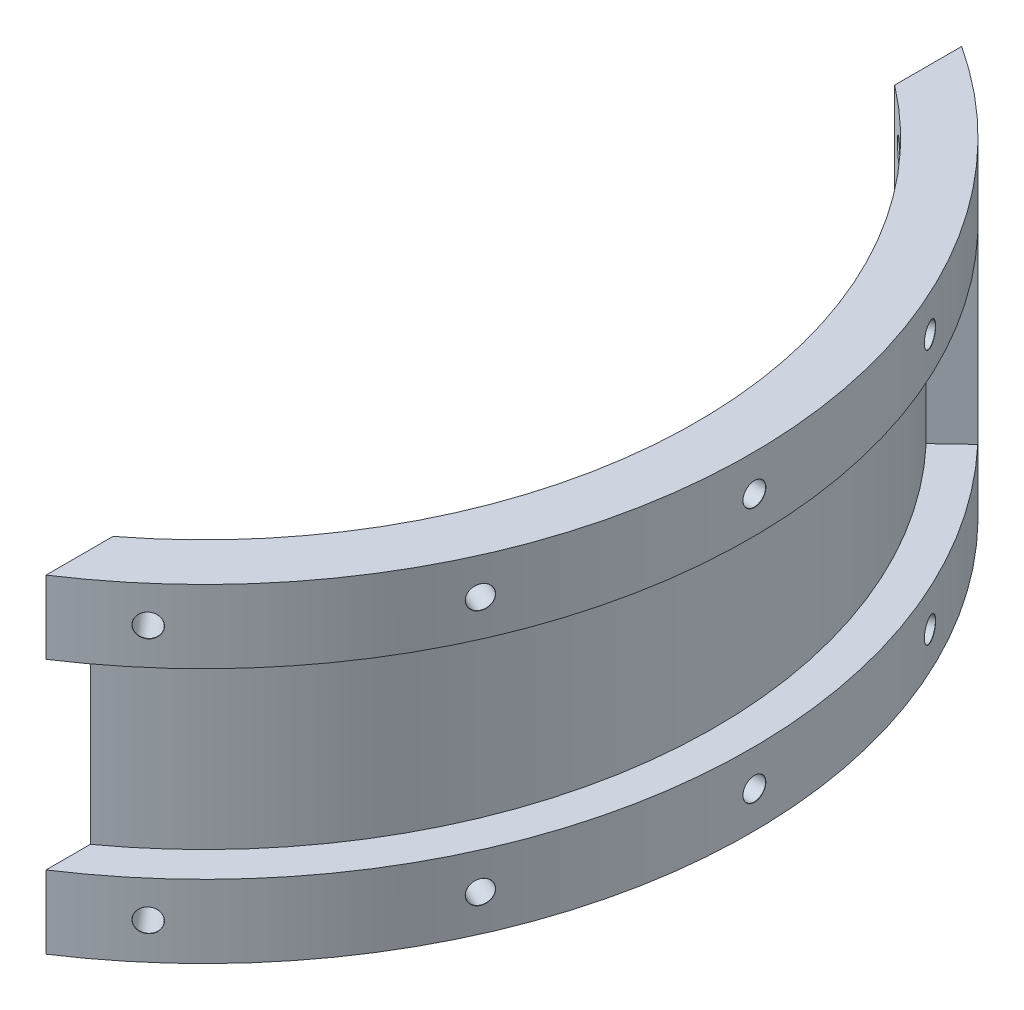
from build123d import *

# Parameters (mm, degrees)
BOSS_EXTRUDE1_DEPTH                             = 36
CUT_EXTRUDE1_DEPTH                              = 10
CUT_EXTRUDE1_DEPTH_BACK                         = 10
CUT_EXTRUDE1_START                              = -18
TAP_DRILL_FOR_M3X0_5_TAP3_D                     = 2.5
TAP_DRILL_FOR_M3X0_5_TAP3_DEPTH                 = 10
TAP_DRILL_FOR_M3X0_5_TAP3_CSINK_D               = 2.55
TAP_DRILL_FOR_M3X0_5_TAP3_CSINK_ANGLE           = 90
TAP_DRILL_FOR_M3X0_5_TAP3_TIP                   = 0.751075774
TAP_DRILL_FOR_M3X0_5_TAP3_ON_FACE_2_D           = 2.5
TAP_DRILL_FOR_M3X0_5_TAP3_ON_FACE_2_DEPTH       = 10
TAP_DRILL_FOR_M3X0_5_TAP3_ON_FACE_2_CSINK_D     = 2.55
TAP_DRILL_FOR_M3X0_5_TAP3_ON_FACE_2_CSINK_ANGLE = 90
TAP_DRILL_FOR_M3X0_5_TAP3_ON_FACE_2_TIP         = 0.751075774
TAP_DRILL_FOR_M3X0_5_TAP3_ON_FACE_3_D           = 2.5
TAP_DRILL_FOR_M3X0_5_TAP3_ON_FACE_3_DEPTH       = 10
TAP_DRILL_FOR_M3X0_5_TAP3_ON_FACE_3_CSINK_D     = 2.55
TAP_DRILL_FOR_M3X0_5_TAP3_ON_FACE_3_CSINK_ANGLE = 90
TAP_DRILL_FOR_M3X0_5_TAP3_ON_FACE_3_TIP         = 0.751075774
TAP_DRILL_FOR_M3X0_5_TAP3_ON_FACE_4_D           = 2.5
TAP_DRILL_FOR_M3X0_5_TAP3_ON_FACE_4_DEPTH       = 10
TAP_DRILL_FOR_M3X0_5_TAP3_ON_FACE_4_CSINK_D     = 2.55
TAP_DRILL_FOR_M3X0_5_TAP3_ON_FACE_4_CSINK_ANGLE = 90
TAP_DRILL_FOR_M3X0_5_TAP3_ON_FACE_4_TIP         = 0.751075774
TAP_DRILL_FOR_M3X0_5_TAP3_ON_FACE_5_D           = 2.5
TAP_DRILL_FOR_M3X0_5_TAP3_ON_FACE_5_DEPTH       = 10
TAP_DRILL_FOR_M3X0_5_TAP3_ON_FACE_5_CSINK_D     = 2.55
TAP_DRILL_FOR_M3X0_5_TAP3_ON_FACE_5_CSINK_ANGLE = 90
TAP_DRILL_FOR_M3X0_5_TAP3_ON_FACE_5_TIP         = 0.751075774
TAP_DRILL_FOR_M3X0_5_TAP3_ON_FACE_6_D           = 2.5
TAP_DRILL_FOR_M3X0_5_TAP3_ON_FACE_6_DEPTH       = 10
TAP_DRILL_FOR_M3X0_5_TAP3_ON_FACE_6_CSINK_D     = 2.55
TAP_DRILL_FOR_M3X0_5_TAP3_ON_FACE_6_CSINK_ANGLE = 90
TAP_DRILL_FOR_M3X0_5_TAP3_ON_FACE_6_TIP         = 0.751075774


with BuildPart() as part:
    # Sketch2 → Boss-Extrude1 (new body)
    with BuildSketch(Plane(origin=(0, 0, 0), x_dir=(1, 0, 0), z_dir=(0, 1, 0))):
        with BuildLine():
            Line((32.857314739, 42.853201375), (32.857314739, 50.203554338))
            ThreePointArc((32.857314739, 50.203554338), (60, 0), (32.857314739, -50.203554338))
            Line((32.857314739, -50.203554338), (32.857314739, -42.853201375))
            ThreePointArc((32.857314739, -42.853201375), (54, 0), (32.857314739, 42.853201375))
        make_face()
    extrude(amount=BOSS_EXTRUDE1_DEPTH)

    # Sketch4 → Cut-Extrude1 (cut, two sides: drawn at the far end of the back side and taken through both)
    with BuildSketch(Plane(origin=(0, 36, 0), x_dir=(1, 0, 0), z_dir=(0, 1, 0)).offset(CUT_EXTRUDE1_START - CUT_EXTRUDE1_DEPTH_BACK)):
        with BuildLine():
            Line((40.630746712, 38.53754561), (43.532942905, 41.290227439))
            ThreePointArc((43.532942905, 41.290227439), (55.124466648, -23.691626724), (0, -60))
            Line((0, -60), (0, -56))
            ThreePointArc((0, -56), (51.449502204, -22.112184942), (40.630746712, 38.53754561))
        make_face()
    extrude(amount=CUT_EXTRUDE1_DEPTH + CUT_EXTRUDE1_DEPTH_BACK, mode=Mode.SUBTRACT)

    # Tap Drill for M3x0.5 Tap3
    with Locations(Plane(origin=(39.244165272, 32, -45.386071565), x_dir=(-0.756434526077, 0, -0.654069421207), z_dir=(0.654069421207, 0, -0.756434526077))):
        with Locations((-1e-09, 0)):
            CounterSinkHole(TAP_DRILL_FOR_M3X0_5_TAP3_D / 2, TAP_DRILL_FOR_M3X0_5_TAP3_CSINK_D / 2, depth=TAP_DRILL_FOR_M3X0_5_TAP3_DEPTH, counter_sink_angle=TAP_DRILL_FOR_M3X0_5_TAP3_CSINK_ANGLE)
            with Locations((0, 0, -(TAP_DRILL_FOR_M3X0_5_TAP3_DEPTH + TAP_DRILL_FOR_M3X0_5_TAP3_TIP / 2))):  # 118° drill point
                Cone(0, TAP_DRILL_FOR_M3X0_5_TAP3_D / 2, TAP_DRILL_FOR_M3X0_5_TAP3_TIP, mode=Mode.SUBTRACT)

    # Tap Drill for M3x0.5 Tap3 on face 2
    with Locations(Plane(origin=(54.492928681, 32, -25.11017172), x_dir=(0.418503157518, 0, 0.908215341837), z_dir=(0.908215341837, 0, -0.418503157518))):
        with Locations((0, 0), (0, 28)):
            CounterSinkHole(TAP_DRILL_FOR_M3X0_5_TAP3_ON_FACE_2_D / 2, TAP_DRILL_FOR_M3X0_5_TAP3_ON_FACE_2_CSINK_D / 2, depth=TAP_DRILL_FOR_M3X0_5_TAP3_ON_FACE_2_DEPTH, counter_sink_angle=TAP_DRILL_FOR_M3X0_5_TAP3_ON_FACE_2_CSINK_ANGLE)
            with Locations((0, 0, -(TAP_DRILL_FOR_M3X0_5_TAP3_ON_FACE_2_DEPTH + TAP_DRILL_FOR_M3X0_5_TAP3_ON_FACE_2_TIP / 2))):  # 118° drill point
                Cone(0, TAP_DRILL_FOR_M3X0_5_TAP3_ON_FACE_2_D / 2, TAP_DRILL_FOR_M3X0_5_TAP3_ON_FACE_2_TIP, mode=Mode.SUBTRACT)

    # Tap Drill for M3x0.5 Tap3 on face 3
    with Locations(Plane(origin=(59.999008842, 32, -0.344873796), x_dir=(0.00574800276, 0, 0.999983480096), z_dir=(0.999983480096, 0, -0.00574800276))):
        with Locations((0, 0), (0, 28)):
            CounterSinkHole(TAP_DRILL_FOR_M3X0_5_TAP3_ON_FACE_3_D / 2, TAP_DRILL_FOR_M3X0_5_TAP3_ON_FACE_3_CSINK_D / 2, depth=TAP_DRILL_FOR_M3X0_5_TAP3_ON_FACE_3_DEPTH, counter_sink_angle=TAP_DRILL_FOR_M3X0_5_TAP3_ON_FACE_3_CSINK_ANGLE)
            with Locations((0, 0, -(TAP_DRILL_FOR_M3X0_5_TAP3_ON_FACE_3_DEPTH + TAP_DRILL_FOR_M3X0_5_TAP3_ON_FACE_3_TIP / 2))):  # 118° drill point
                Cone(0, TAP_DRILL_FOR_M3X0_5_TAP3_ON_FACE_3_D / 2, TAP_DRILL_FOR_M3X0_5_TAP3_ON_FACE_3_TIP, mode=Mode.SUBTRACT)

    # Tap Drill for M3x0.5 Tap3 on face 4
    with Locations(Plane(origin=(54.777984544, 32, 24.482083434), x_dir=(-0.408035106419, 0, 0.91296623811), z_dir=(0.91296623811, 0, 0.408035106419))):
        with Locations((-1e-09, 0), (-1e-09, 28)):
            CounterSinkHole(TAP_DRILL_FOR_M3X0_5_TAP3_ON_FACE_4_D / 2, TAP_DRILL_FOR_M3X0_5_TAP3_ON_FACE_4_CSINK_D / 2, depth=TAP_DRILL_FOR_M3X0_5_TAP3_ON_FACE_4_DEPTH, counter_sink_angle=TAP_DRILL_FOR_M3X0_5_TAP3_ON_FACE_4_CSINK_ANGLE)
            with Locations((0, 0, -(TAP_DRILL_FOR_M3X0_5_TAP3_ON_FACE_4_DEPTH + TAP_DRILL_FOR_M3X0_5_TAP3_ON_FACE_4_TIP / 2))):  # 118° drill point
                Cone(0, TAP_DRILL_FOR_M3X0_5_TAP3_ON_FACE_4_D / 2, TAP_DRILL_FOR_M3X0_5_TAP3_ON_FACE_4_TIP, mode=Mode.SUBTRACT)

    # Tap Drill for M3x0.5 Tap3 on face 5
    with Locations(Plane(origin=(39.244165272, 32, 45.386071565), x_dir=(0.756434937221, 0, -0.654068945717), z_dir=(0.654068945717, 0, 0.756434937221))):
        with Locations((1e-09, 0), (1e-09, -28)):
            CounterSinkHole(TAP_DRILL_FOR_M3X0_5_TAP3_ON_FACE_5_D / 2, TAP_DRILL_FOR_M3X0_5_TAP3_ON_FACE_5_CSINK_D / 2, depth=TAP_DRILL_FOR_M3X0_5_TAP3_ON_FACE_5_DEPTH, counter_sink_angle=TAP_DRILL_FOR_M3X0_5_TAP3_ON_FACE_5_CSINK_ANGLE)
            with Locations((0, 0, -(TAP_DRILL_FOR_M3X0_5_TAP3_ON_FACE_5_DEPTH + TAP_DRILL_FOR_M3X0_5_TAP3_ON_FACE_5_TIP / 2))):  # 118° drill point
                Cone(0, TAP_DRILL_FOR_M3X0_5_TAP3_ON_FACE_5_D / 2, TAP_DRILL_FOR_M3X0_5_TAP3_ON_FACE_5_TIP, mode=Mode.SUBTRACT)

    # Tap Drill for M3x0.5 Tap3 on face 6
    with Locations(Plane(origin=(39.244165272, 4, -45.386071565), x_dir=(-0.756434937221, 0, -0.654068945717), z_dir=(0.654068945717, 0, -0.756434937221))):
        with Locations((-1e-09, 0)):
            CounterSinkHole(TAP_DRILL_FOR_M3X0_5_TAP3_ON_FACE_6_D / 2, TAP_DRILL_FOR_M3X0_5_TAP3_ON_FACE_6_CSINK_D / 2, depth=TAP_DRILL_FOR_M3X0_5_TAP3_ON_FACE_6_DEPTH, counter_sink_angle=TAP_DRILL_FOR_M3X0_5_TAP3_ON_FACE_6_CSINK_ANGLE)
            with Locations((0, 0, -(TAP_DRILL_FOR_M3X0_5_TAP3_ON_FACE_6_DEPTH + TAP_DRILL_FOR_M3X0_5_TAP3_ON_FACE_6_TIP / 2))):  # 118° drill point
                Cone(0, TAP_DRILL_FOR_M3X0_5_TAP3_ON_FACE_6_D / 2, TAP_DRILL_FOR_M3X0_5_TAP3_ON_FACE_6_TIP, mode=Mode.SUBTRACT)


solid = part.part
